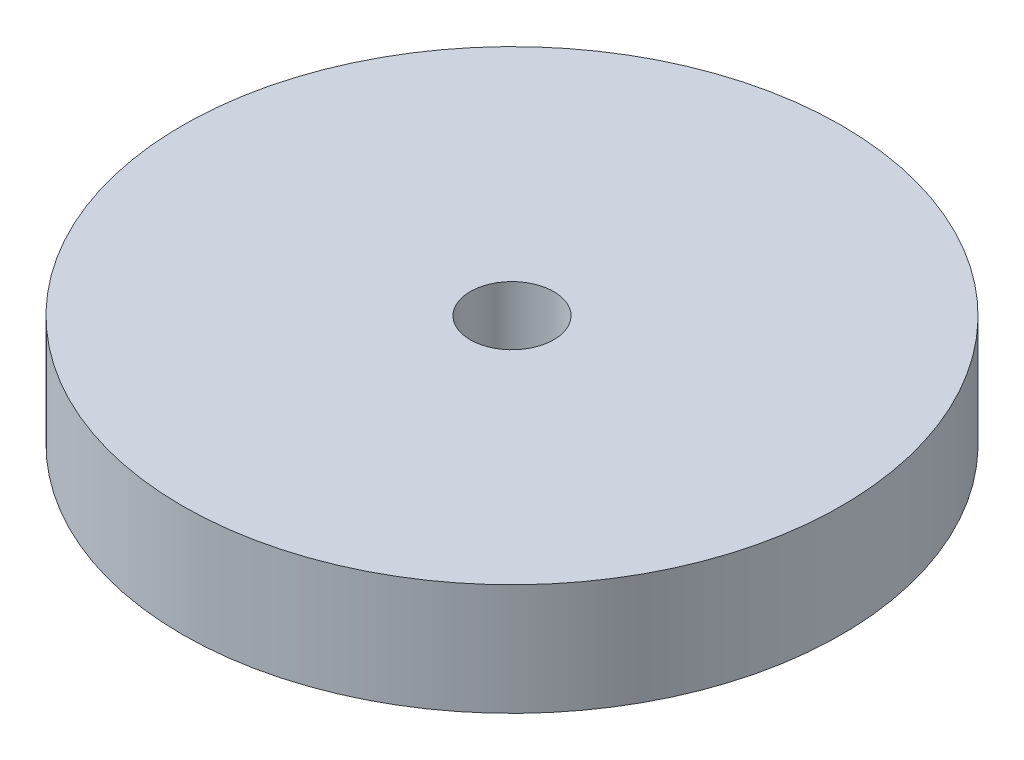
from build123d import *

# Parameters (mm, degrees)
SKETCH1_R           = 35.5
BOSS_EXTRUDE1_DEPTH = 12
SKETCH2_R           = 4.5
CUT_EXTRUDE1_DEPTH  = 52.618795027


with BuildPart() as part:
    # Sketch1 → Boss-Extrude1 (new body)
    with BuildSketch(Plane(origin=(0, 0, 0), x_dir=(1, 0, 0), z_dir=(0, 1, 0))):
        with Locations(Location((0, 0, 0), (0, 0, 270))):
            Circle(SKETCH1_R)
    extrude(amount=BOSS_EXTRUDE1_DEPTH)

    # Sketch2 → Cut-Extrude1 (cut, through all)
    with BuildSketch(Plane(origin=(0, 12, 0), x_dir=(1, 0, 0), z_dir=(0, 1, 0))):
        with Locations(Location((0, 0, 0), (0, 0, 270))):
            Circle(SKETCH2_R)
    extrude(amount=-CUT_EXTRUDE1_DEPTH, mode=Mode.SUBTRACT)


solid = part.part
